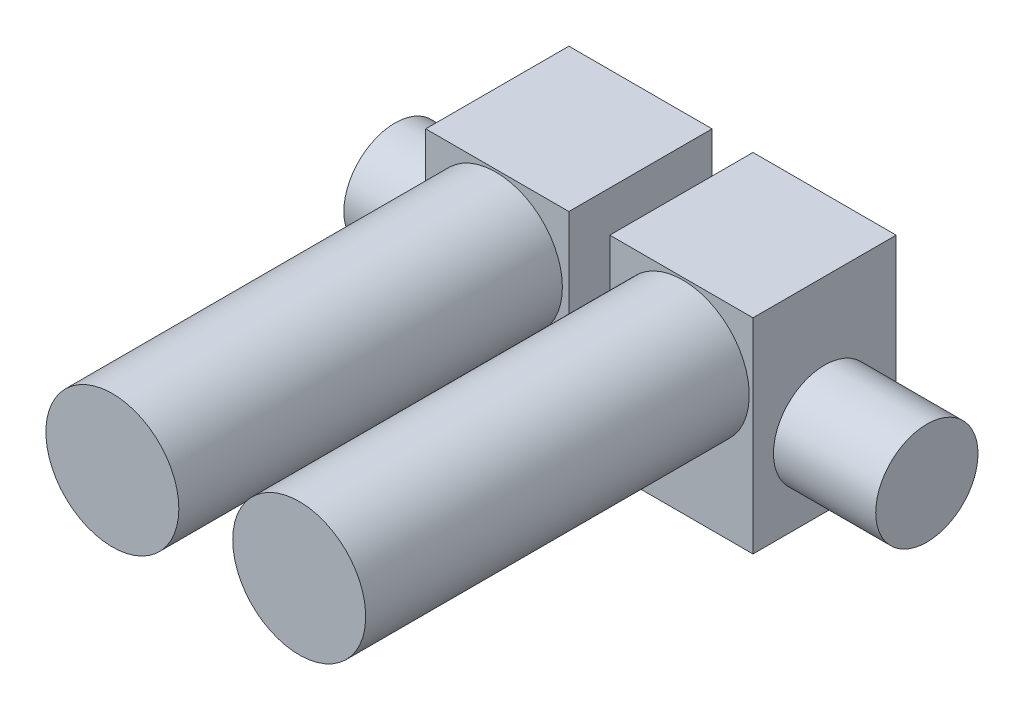
from build123d import *

# Parameters (mm, degrees)
ESQUISSE1_W             = 64
ESQUISSE1_H             = 40
BOSS_EXTRU_1_DEPTH      = 28
ESQUISSE2_R             = 13
BOSS_EXTRU_2_DEPTH      = 75
ESQUISSE3_R             = 10
BOSS_EXTRU_3_DEPTH      = 20
ESQUISSE4_R             = 10
BOSS_EXTRU_4_DEPTH      = 20
ESQUISSE9_W             = 8
ESQUISSE9_H             = 40
ENL_V_MAT_EXTRU_1_DEPTH = 28


with BuildPart() as part:
    # Esquisse1 → Boss.-Extru.1 (new body)
    with BuildSketch(Plane.XY):
        with Locations((32, -20)):
            Rectangle(ESQUISSE1_W, ESQUISSE1_H)
    extrude(amount=BOSS_EXTRU_1_DEPTH)

    # Esquisse2 → Boss.-Extru.2 (add)
    with BuildSketch(Plane.XY.offset(28)):
        with Locations((13.7306196, -13.455237163)):
            Circle(ESQUISSE2_R)
        with Locations(Location((50.2693804, -13.455237163, 0), (0, 0, 180))):
            Circle(ESQUISSE2_R)
    extrude(amount=BOSS_EXTRU_2_DEPTH)

    # Esquisse3 → Boss.-Extru.3 (add)
    with BuildSketch(Plane.ZY):
        with Locations(Location((14, -26, 0), (0, 0, 90))):
            Circle(ESQUISSE3_R)
    extrude(amount=BOSS_EXTRU_3_DEPTH)

    # Esquisse4 → Boss.-Extru.4 (add)
    with BuildSketch(Plane(origin=(64, 0, 0), x_dir=(0, 0, -1), z_dir=(1, 0, 0))):
        with Locations(Location((-14, -25, 0), (0, 0, 180))):
            Circle(ESQUISSE4_R)
    extrude(amount=BOSS_EXTRU_4_DEPTH)

    # Esquisse9 → Enlèv. mat.-Extru.1 (cut)
    with BuildSketch(Plane.XY.offset(28)):
        with Locations((32, -20)):
            Rectangle(ESQUISSE9_W, ESQUISSE9_H)
    extrude(amount=-ENL_V_MAT_EXTRU_1_DEPTH, mode=Mode.SUBTRACT)


with BuildPart() as enl_v_mat_extru_1_piece_1:
    # of the separate pieces the step leaves, piece 1, a body of its own (enl_v_mat_extru_1_pieces)
    add(part.part.solids().sort_by_distance((36, 0, 0))[0])


with BuildPart() as enl_v_mat_extru_1_piece_2:
    # of the separate pieces the step leaves, piece 2, a body of its own (enl_v_mat_extru_1_pieces)
    add(part.part.solids().sort_by_distance((0, 0, 0))[0])


solid = Compound([enl_v_mat_extru_1_piece_1.part, enl_v_mat_extru_1_piece_2.part])
